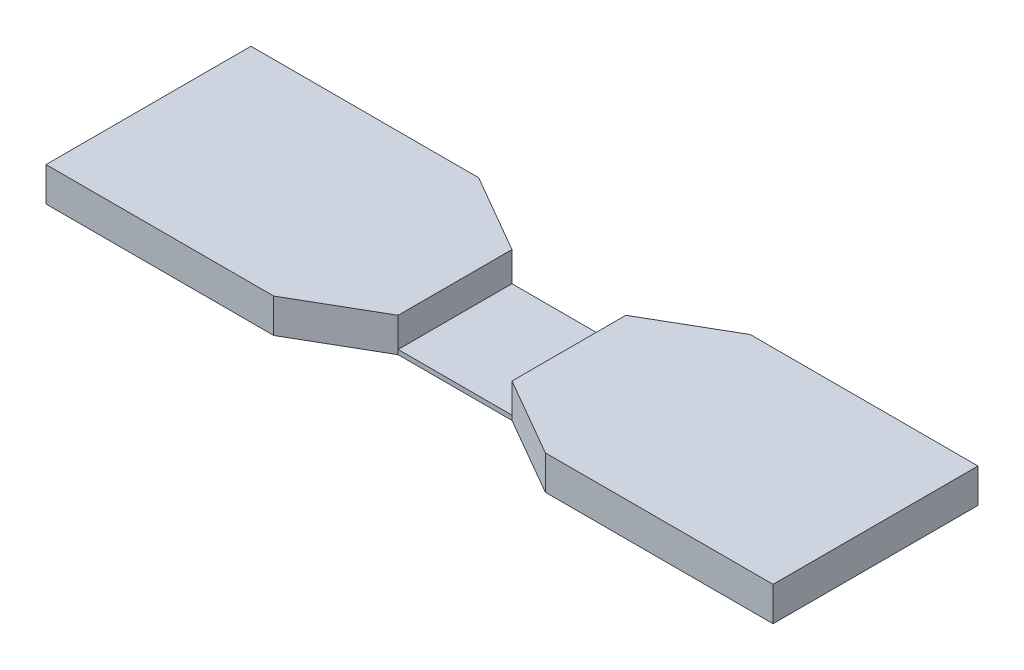
from build123d import *

# Parameters (mm, degrees)
BOSS_EXTRUDE1_DEPTH   = 3
BOSS_EXTRUDE1_2_DEPTH = 3
SKETCH1_3_W           = 10
SKETCH1_3_H           = 10
BOSS_EXTRUDE2_DEPTH   = 0.4


with BuildPart() as part:
    # Sketch1 → Boss-Extrude1 (new body)
    with BuildSketch(Plane(origin=(0, 0, 0), x_dir=(1, 0, 0), z_dir=(0, 1, 0))):
        Polygon((6.92820323, 9.029673591), (0, 5.029673591), (0, -4.970326409), (6.92820323, -8.970326409), (26.92820323, -8.970326409), (26.92820323, 9.029673591), align=None)
    extrude(amount=BOSS_EXTRUDE1_DEPTH)



with BuildPart() as body_2:
    # Sketch1 → Boss-Extrude1 2 (new body)
    with BuildSketch(Plane(origin=(0, 0, 0), x_dir=(1, 0, 0), z_dir=(0, 1, 0))):
        Polygon((-10, -4.970326409), (-10, 5.029673591), (-16.92820323, 9.029673591), (-36.92820323, 9.029673591), (-36.92820323, -8.970326409), (-16.92820323, -8.970326409), align=None)
    extrude(amount=BOSS_EXTRUDE1_2_DEPTH)


with BuildPart() as part_1:
    add(part.part)

    add(body_2.part)  # Boss-Extrude2 merges body 2
    # Sketch1<3> → Boss-Extrude2 (add)
    with BuildSketch(Plane(origin=(0, 0, 0), x_dir=(1, 0, 0), z_dir=(0, 1, 0))):
        with Locations((-5, 0.029673591)):
            Rectangle(SKETCH1_3_W, SKETCH1_3_H)
    extrude(amount=BOSS_EXTRUDE2_DEPTH)


solid = part_1.part
